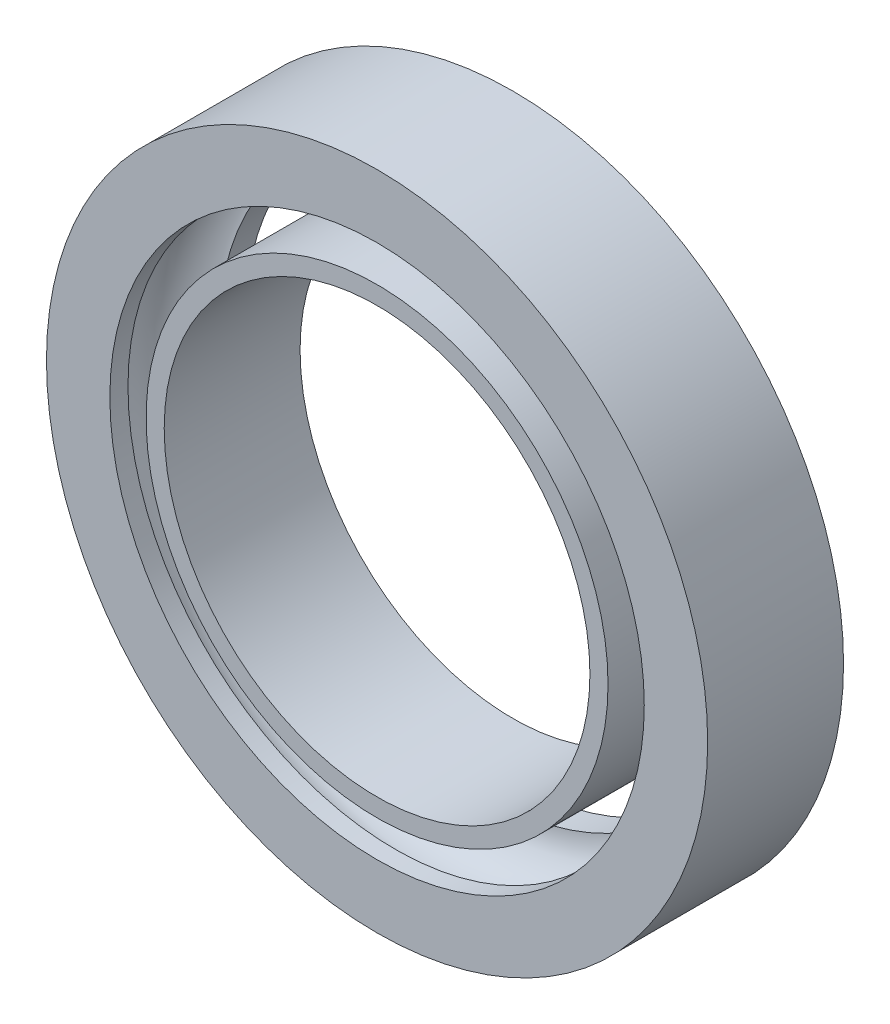
from build123d import *

# Parameters (mm, degrees)
SKETCH_1_R      = 25.5
SKETCH_1_R_2    = 23.5
EXTRUDE_2_DEPTH = 15
SKETCH_3_R      = 36.5
SKETCH_3_R_2    = 29.5
EXTRUDE_3_DEPTH = 15


with BuildPart() as part:
    # 草图1 → 凸台-拉伸2 (new body)
    with BuildSketch(Plane.XY):
        Circle(SKETCH_1_R)
        Circle(SKETCH_1_R_2, mode=Mode.SUBTRACT)
    extrude(amount=EXTRUDE_2_DEPTH)


with BuildPart() as body_2:
    # 草图3 → 凸台-拉伸3 (new body)
    with BuildSketch(Plane.XY):
        Circle(SKETCH_3_R)
        Circle(SKETCH_3_R_2, mode=Mode.SUBTRACT)
    extrude(amount=EXTRUDE_3_DEPTH)

    # 草图5 → 切除-旋转2 (revolve, cut)
    with BuildSketch(Plane(origin=(0, 0, 0), x_dir=(1, 0, 0), z_dir=(0, 1, 0))):
        with BuildLine():
            Line((-29.5, -3), (-29.5, -13))
            ThreePointArc((-29.5, -13), (-34.5, -8), (-29.5, -3))
        make_face()
    revolve(axis=Axis((0, 0, 0), (0, 0, 1)), mode=Mode.SUBTRACT)


solid = Compound([part.part, body_2.part])
